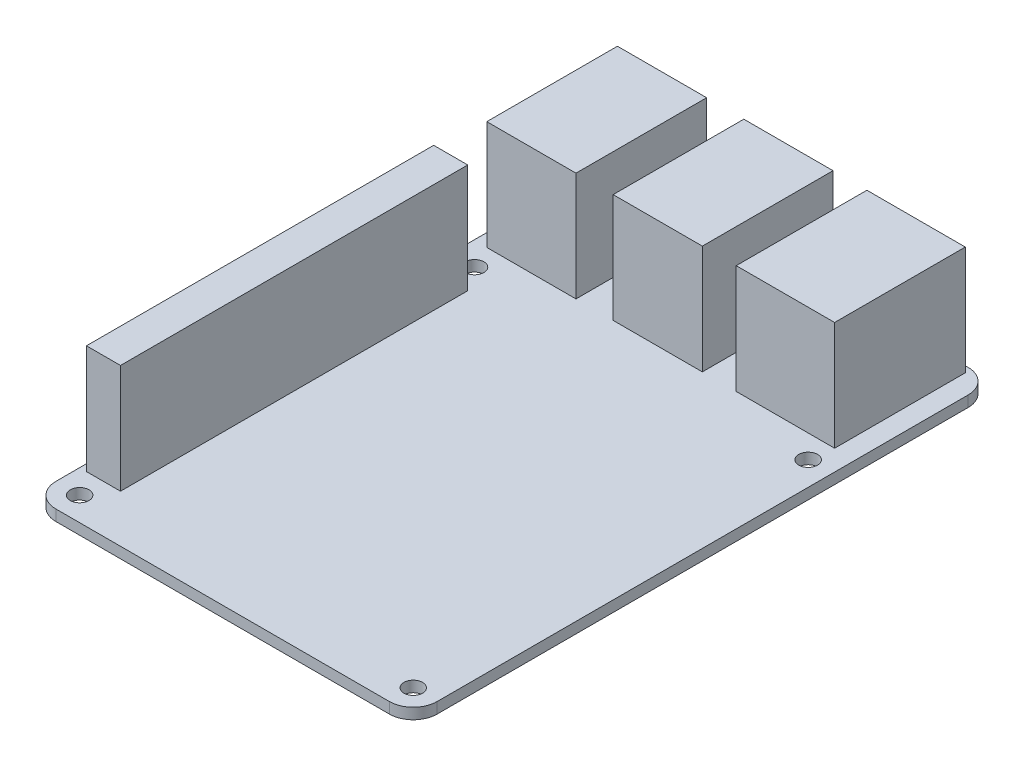
from build123d import *

# Parameters (mm, degrees)
SKETCH1_W           = 56
SKETCH1_H           = 85
SKETCH1_R           = 1.375
BOSS_EXTRUDE1_DEPTH = 1.6
FILLET1_R           = 3.5
SKETCH3_W           = 13.1
SKETCH3_H           = 19.189632287
SKETCH3_W_2         = 14.44866431
BOSS_EXTRUDE2_DEPTH = 16
SKETCH5_W           = 5
SKETCH5_H           = 51
BOSS_EXTRUDE3_DEPTH = 16


with BuildPart() as part:
    # Sketch1 → Boss-Extrude1 (new body)
    with BuildSketch(Plane(origin=(0, 0, 0), x_dir=(1, 0, 0), z_dir=(0, 1, 0))):
        with Locations((28, 42.5)):
            Rectangle(SKETCH1_W, SKETCH1_H)
        with Locations(Location((3.5, 3.5, 0), (0, 0, 270))):
            Circle(SKETCH1_R, mode=Mode.SUBTRACT)
        with Locations(Location((52.5, 3.5, 0), (0, 0, 270))):
            Circle(SKETCH1_R, mode=Mode.SUBTRACT)
        with Locations(Location((52.5, 61.5, 0), (0, 0, 270))):
            Circle(SKETCH1_R, mode=Mode.SUBTRACT)
        with Locations(Location((3.5, 61.5, 0), (0, 0, 270))):
            Circle(SKETCH1_R, mode=Mode.SUBTRACT)
    extrude(amount=BOSS_EXTRUDE1_DEPTH)

    # Fillet1
    fillet1_edges = [part.edges().sort_by_distance(p)[0] for p in [
        (0, 0.8, -85),
        (56, 0.8, -85),
        (56, 0.8, 0),
        (0, 0.8, 0),
    ]]
    fillet(fillet1_edges, radius=FILLET1_R)

    # Sketch3 → Boss-Extrude2 (add)
    with BuildSketch(Plane(origin=(0, 1.6, 0), x_dir=(1, 0, 0), z_dir=(0, 1, 0))):
        with Locations((8.438548035, 74.501533843)):
            Rectangle(SKETCH3_W, SKETCH3_H)
        with Locations((27, 74.501533843)):
            Rectangle(SKETCH3_W, SKETCH3_H)
        with Locations((45.75, 74.501533843)):
            Rectangle(SKETCH3_W_2, SKETCH3_H)
    extrude(amount=BOSS_EXTRUDE2_DEPTH)

    # Sketch5 → Boss-Extrude3 (add)
    with BuildSketch(Plane(origin=(0, 1.6, 0), x_dir=(1, 0, 0), z_dir=(0, 1, 0))):
        with Locations((3.5, 32.5)):
            Rectangle(SKETCH5_W, SKETCH5_H)
    extrude(amount=BOSS_EXTRUDE3_DEPTH)


solid = part.part
